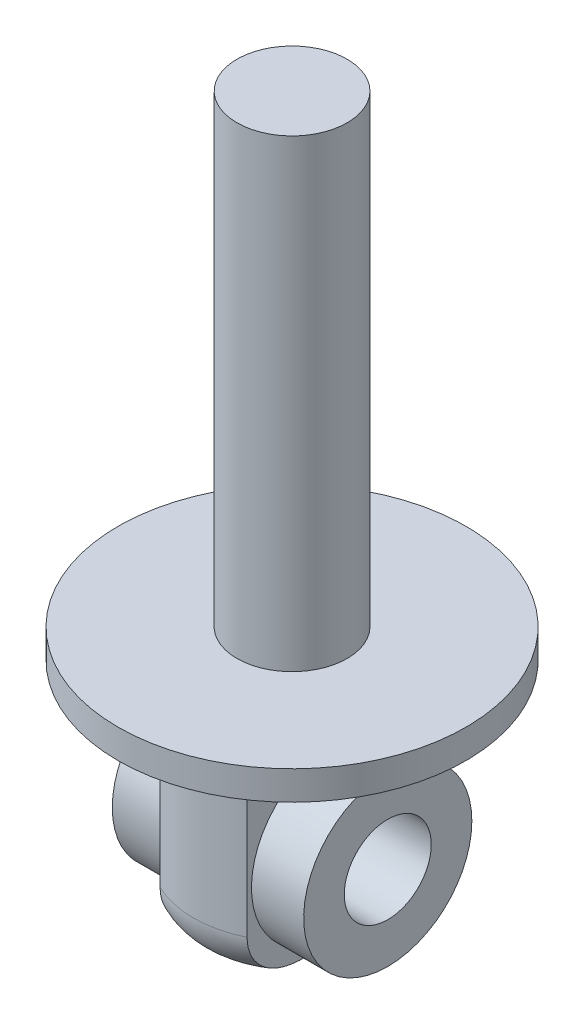
from build123d import *

# Parameters (mm, degrees)
SKETCH1_R               = 30
BOSS_EXTRUDE1_DEPTH     = 5
SKETCH2_R               = 9.5
BOSS_EXTRUDE2_DEPTH     = 80
SKETCH3_R               = 17
BOSS_EXTRUDE3_DEPTH     = 38
FILLET1_R               = 8
SKETCH4_W               = 21.418583827
SKETCH4_H               = 30
CUT_EXTRUDE1_DEPTH      = 19
CUT_EXTRUDE2_DEPTH      = 98.628120949
CUT_EXTRUDE2_DEPTH_BACK = 98.628120949
SKETCH8_R               = 7.5
SKETCH9_R               = 14.5
SKETCH9_R_2             = 7.5
BOSS_EXTRUDE4_DEPTH     = 16.5


with BuildPart() as part:
    # Sketch1 → Boss-Extrude1 (new body)
    with BuildSketch(Plane(origin=(0, 0, 0), x_dir=(1, 0, 0), z_dir=(0, 1, 0))):
        with Locations(Location((0, 0, 0), (0, 0, 270))):
            Circle(SKETCH1_R)
    extrude(amount=BOSS_EXTRUDE1_DEPTH)

    # Sketch2 → Boss-Extrude2 (add)
    with BuildSketch(Plane(origin=(0, 5, 0), x_dir=(1, 0, 0), z_dir=(0, 1, 0))):
        with Locations(Location((0, 0, 0), (0, 0, 270))):
            Circle(SKETCH2_R)
    extrude(amount=BOSS_EXTRUDE2_DEPTH)

    # Sketch3 → Boss-Extrude3 (add)
    with BuildSketch(Plane.XZ):
        with Locations(Location((0, 0, 0), (0, 0, 270))):
            Circle(SKETCH3_R)
    extrude(amount=BOSS_EXTRUDE3_DEPTH)

    # Fillet1
    fillet1_edges = [part.edges().sort_by_distance(p)[0] for p in [
        (0, -38, 17),
    ]]
    fillet(fillet1_edges, radius=FILLET1_R)

    # Sketch4 → Cut-Extrude1 (cut, symmetric)
    with BuildSketch(Plane.XY):
        with Locations((-18.209291914, -23)):
            Rectangle(SKETCH4_W, SKETCH4_H)
        with Locations((18.209291914, -23)):
            Rectangle(SKETCH4_W, SKETCH4_H)
    extrude(amount=CUT_EXTRUDE1_DEPTH, both=True, mode=Mode.SUBTRACT)

    # Sketch8 → Cut-Extrude2 (cut, two sides: drawn at the far end of the back side and taken through both)
    with BuildSketch(Plane(origin=(7.5, 0, 0), x_dir=(0, 0, -1), z_dir=(1, 0, 0)).offset(-CUT_EXTRUDE2_DEPTH_BACK)):
        with Locations(Location((0, -23, 0), (0, 0, 180))):
            Circle(SKETCH8_R)
    extrude(amount=CUT_EXTRUDE2_DEPTH + CUT_EXTRUDE2_DEPTH_BACK, mode=Mode.SUBTRACT)

    # Sketch9 → Boss-Extrude4 (add, symmetric)
    with BuildSketch(Plane(origin=(0, 0, 0), x_dir=(0, 0, -1), z_dir=(1, 0, 0))):
        with Locations(Location((0, -23, 0), (0, 0, 180))):
            Circle(SKETCH9_R)
        with Locations((0, -23)):
            Circle(SKETCH9_R_2, mode=Mode.SUBTRACT)
    extrude(amount=BOSS_EXTRUDE4_DEPTH, both=True)


solid = part.part
